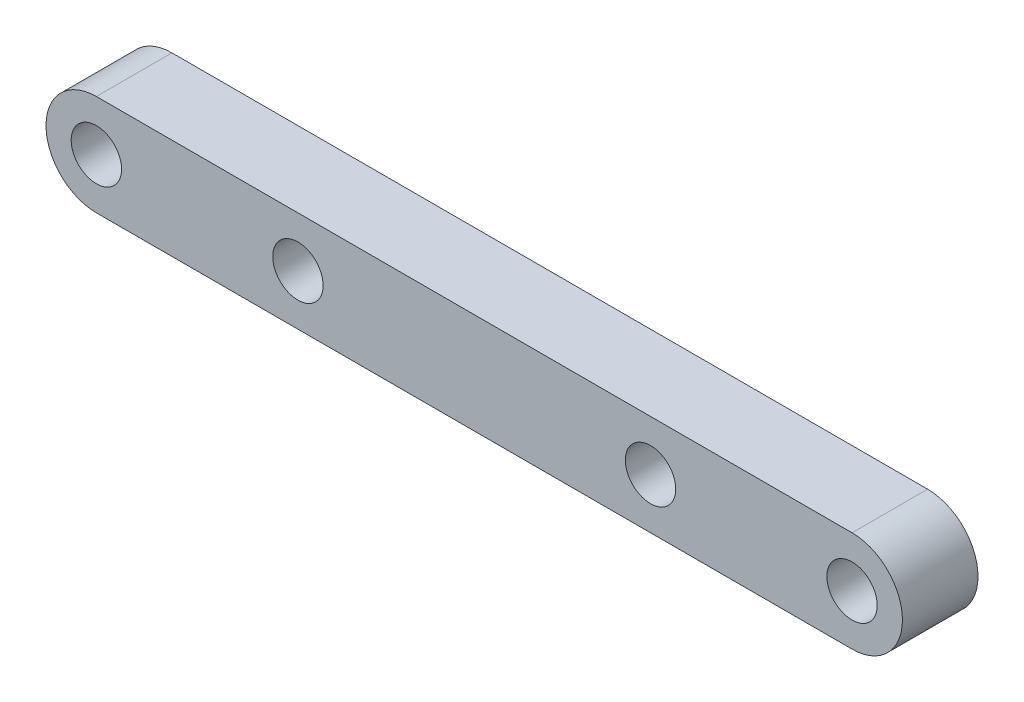
from build123d import *

# Parameters (mm, degrees)
SKETCH1_R           = 1
BOSS_EXTRUDE1_DEPTH = 3


with BuildPart() as part:
    # Sketch1 → Boss-Extrude1 (new body)
    with BuildSketch(Plane.XY):
        with BuildLine():
            Line((-15, 2), (15, 2))
            ThreePointArc((15, 2), (17, 0), (15, -2))
            Line((15, -2), (-15, -2))
            ThreePointArc((-15, -2), (-17, 0), (-15, 2))
        make_face()
        with Locations((15, 0)):
            Circle(SKETCH1_R, mode=Mode.SUBTRACT)
        with Locations((-15, 0)):
            Circle(SKETCH1_R, mode=Mode.SUBTRACT)
        with Locations((-7, 0)):
            Circle(SKETCH1_R, mode=Mode.SUBTRACT)
        with Locations(Location((7, 0, 0), (0, 0, 180))):
            Circle(SKETCH1_R, mode=Mode.SUBTRACT)
    extrude(amount=BOSS_EXTRUDE1_DEPTH)


solid = part.part
